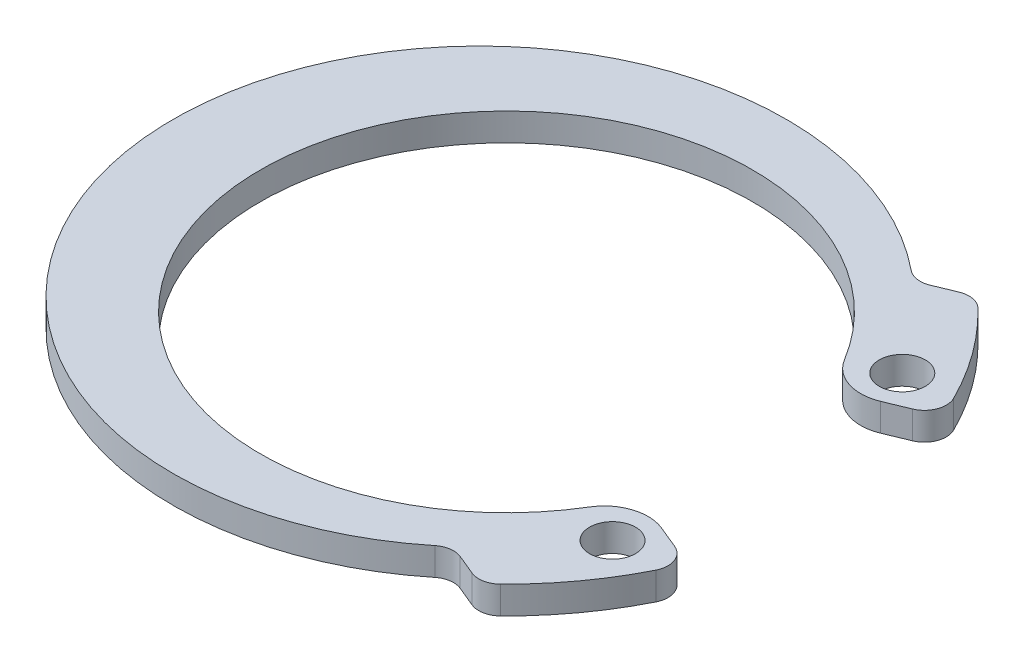
from build123d import *

# Parameters (mm, degrees)
BOSS_EXTRUDE1_DEPTH      = 0.3
BOSS_EXTRUDE1_DEPTH_BACK = 0.3
SKETCH3_R                = 0.5


with BuildPart() as part:
    # Sketch3 → Boss-Extrude1 (new, two sides: drawn at the far end of the back side and taken through both)
    with BuildSketch(Plane(origin=(0, 0, 0), x_dir=(1, 0, 0), z_dir=(0, 1, 0)).offset(-BOSS_EXTRUDE1_DEPTH_BACK)):
        with BuildLine():
            Line((4.102740922, 5.108946364), (4.545279847, 5.292251988))
            ThreePointArc((4.545279847, 5.292251988), (4.816648416, 5.319883139), (5.058471581, 5.193685133))
            ThreePointArc((5.058471581, 5.193685133), (5.85509364, 4.275555925), (6.487124998, 3.237237906))
            ThreePointArc((6.487124998, 3.237237906), (6.507055281, 2.8588735), (6.243881094, 2.586300231))
            Line((6.243881094, 2.586300231), (5.753885829, 2.383337547))
            ThreePointArc((5.753885829, 2.383337547), (5.094192763, 2.358361014), (4.577508038, 2.769281524))
            ThreePointArc((4.577508038, 2.769281524), (-5.35, 0), (4.577508038, -2.769281524))
            ThreePointArc((4.577508038, -2.769281524), (5.094192763, -2.358361014), (5.753885829, -2.383337547))
            Line((5.753885829, -2.383337547), (6.243881094, -2.586300231))
            ThreePointArc((6.243881094, -2.586300231), (6.507055281, -2.8588735), (6.487124998, -3.237237906))
            ThreePointArc((6.487124998, -3.237237906), (5.85509364, -4.275555925), (5.058471581, -5.193685133))
            ThreePointArc((5.058471581, -5.193685133), (4.816648416, -5.319883139), (4.545279847, -5.292251988))
            Line((4.545279847, -5.292251988), (4.102740922, -5.108946364))
            ThreePointArc((4.102740922, -5.108946364), (3.852575362, -5.07773842), (3.621674975, -5.178939975))
            ThreePointArc((3.621674975, -5.178939975), (-7.25, 0), (3.621674975, 5.178939975))
            ThreePointArc((3.621674975, 5.178939975), (3.852575362, 5.07773842), (4.102740922, 5.108946364))
        make_face()
        with Locations(Location((5.455960044, -3.15, 0), (0, 0, 270))):
            Circle(SKETCH3_R, mode=Mode.SUBTRACT)
        with Locations(Location((5.455960044, 3.15, 0), (0, 0, 270))):
            Circle(SKETCH3_R, mode=Mode.SUBTRACT)
    extrude(amount=BOSS_EXTRUDE1_DEPTH + BOSS_EXTRUDE1_DEPTH_BACK)


solid = part.part
